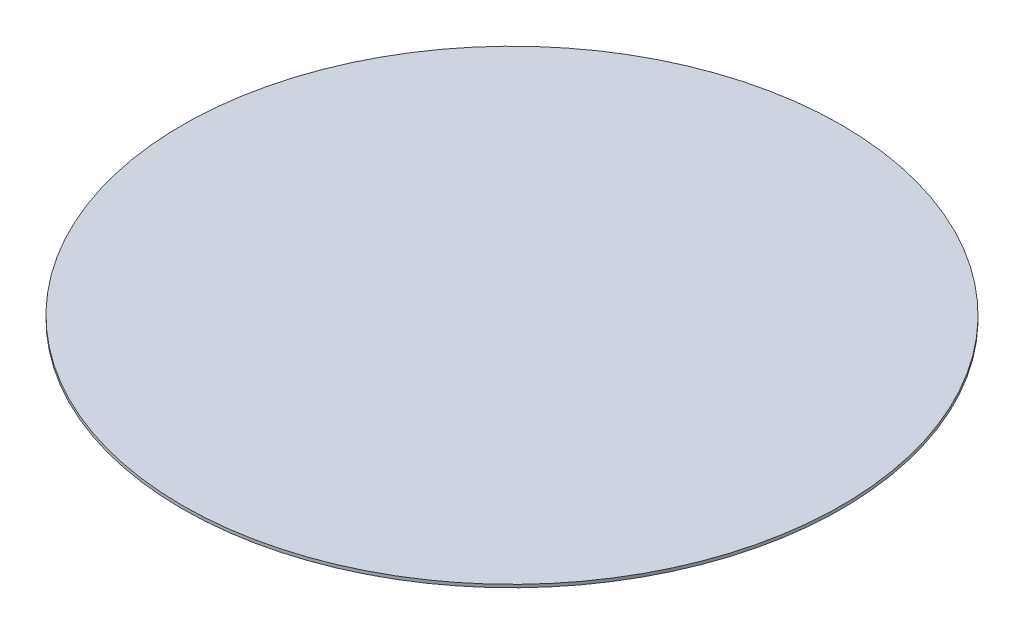
from build123d import *

# Parameters (mm, degrees)
SKETCH1_R           = 27.5
BOSS_EXTRUDE1_DEPTH = 0.25


with BuildPart() as part:
    # Sketch1 → Boss-Extrude1 (new body)
    with BuildSketch(Plane(origin=(0, 0, 0), x_dir=(1, 0, 0), z_dir=(0, 1, 0))):
        with Locations(Location((0, 0, 0), (0, 0, 270))):
            Circle(SKETCH1_R)
    extrude(amount=BOSS_EXTRUDE1_DEPTH)


solid = part.part
